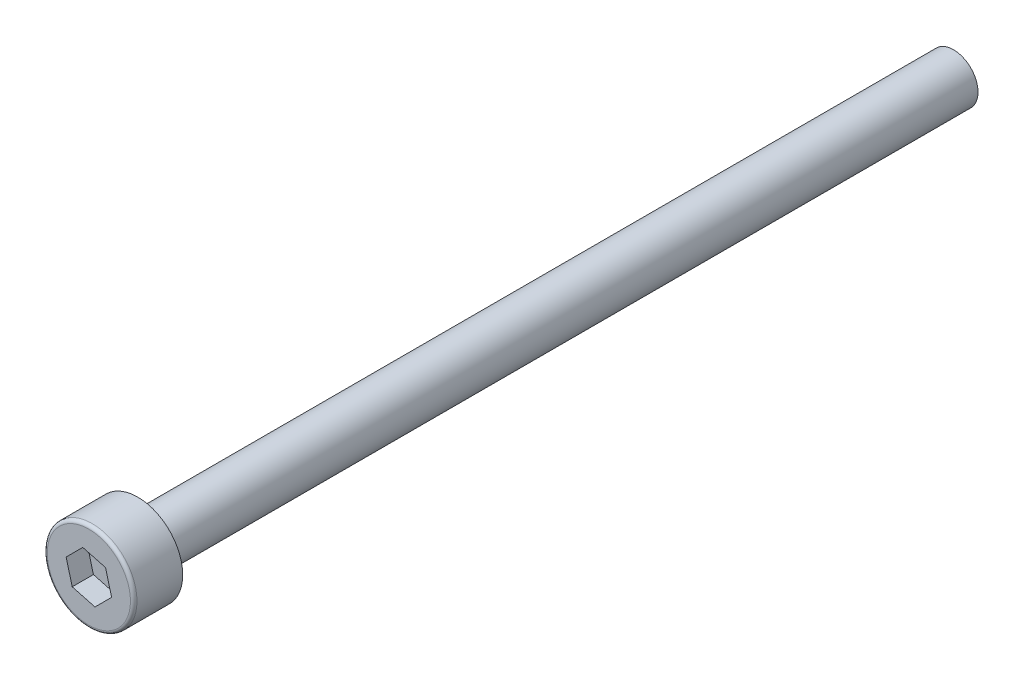
from build123d import *

# Parameters (mm, degrees)
SKETCH_1_R          = 2.75
EXTRUDE_1_DEPTH     = 3
CUT_EXTRUDE_1_DEPTH = 1.3
SKETCH_3_R          = 1.5
EXTRUDE_2_DEPTH     = 50
FILLET_1_R          = 0.2


with BuildPart() as part:
    # 草图1 → 凸台-拉伸1 (new body)
    with BuildSketch(Plane.XY):
        Circle(SKETCH_1_R)
    extrude(amount=EXTRUDE_1_DEPTH)

    # 草图2 → 切除-拉伸1 (cut)
    with BuildSketch(Plane.XY.offset(3)):
        Polygon((-1.020620726, -1.020620726), (0.373573113, -1.39419384), (1.39419384, -0.373573113), (1.020620726, 1.020620726), (-0.373573113, 1.39419384), (-1.39419384, 0.373573113), align=None)
    extrude(amount=-CUT_EXTRUDE_1_DEPTH, mode=Mode.SUBTRACT)

    # 草图3 → 凸台-拉伸2 (add)
    with BuildSketch(Plane(origin=(0, 0, 0), x_dir=(-1, 0, 0), z_dir=(0, 0, -1))):
        with Locations(Location((0, 0, 0), (0, 0, 180))):
            Circle(SKETCH_3_R)
    extrude(amount=EXTRUDE_2_DEPTH)

    # 圆角1
    fillet_1_edges = [part.edges().sort_by_distance(p)[0] for p in [
        (-2.75, 0, 3),
    ]]
    fillet(fillet_1_edges, radius=FILLET_1_R)


solid = part.part
